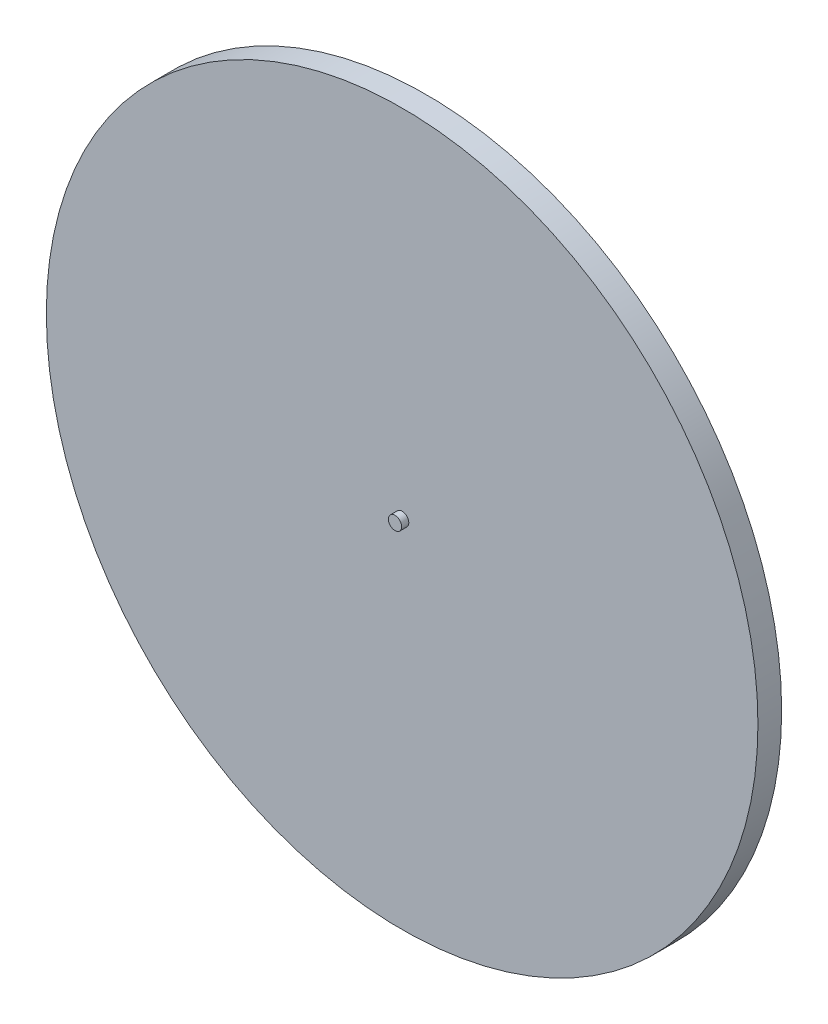
from build123d import *

# Parameters (mm, degrees)
SKETCH_1_R      = 2.8
EXTRUDE_1_DEPTH = 3
SKETCH_2_R      = 150
EXTRUDE_2_DEPTH = 10


with BuildPart() as part:
    # 草图1 → 凸台-拉伸1 (new body)
    with BuildSketch(Plane.XY):
        Circle(SKETCH_1_R)
    extrude(amount=EXTRUDE_1_DEPTH)

    # 草图2 → 凸台-拉伸2 (add)
    with BuildSketch(Plane(origin=(0, 0, 0), x_dir=(-1, 0, 0), z_dir=(0, 0, -1))):
        Circle(SKETCH_2_R)
    extrude(amount=EXTRUDE_2_DEPTH)


solid = part.part
